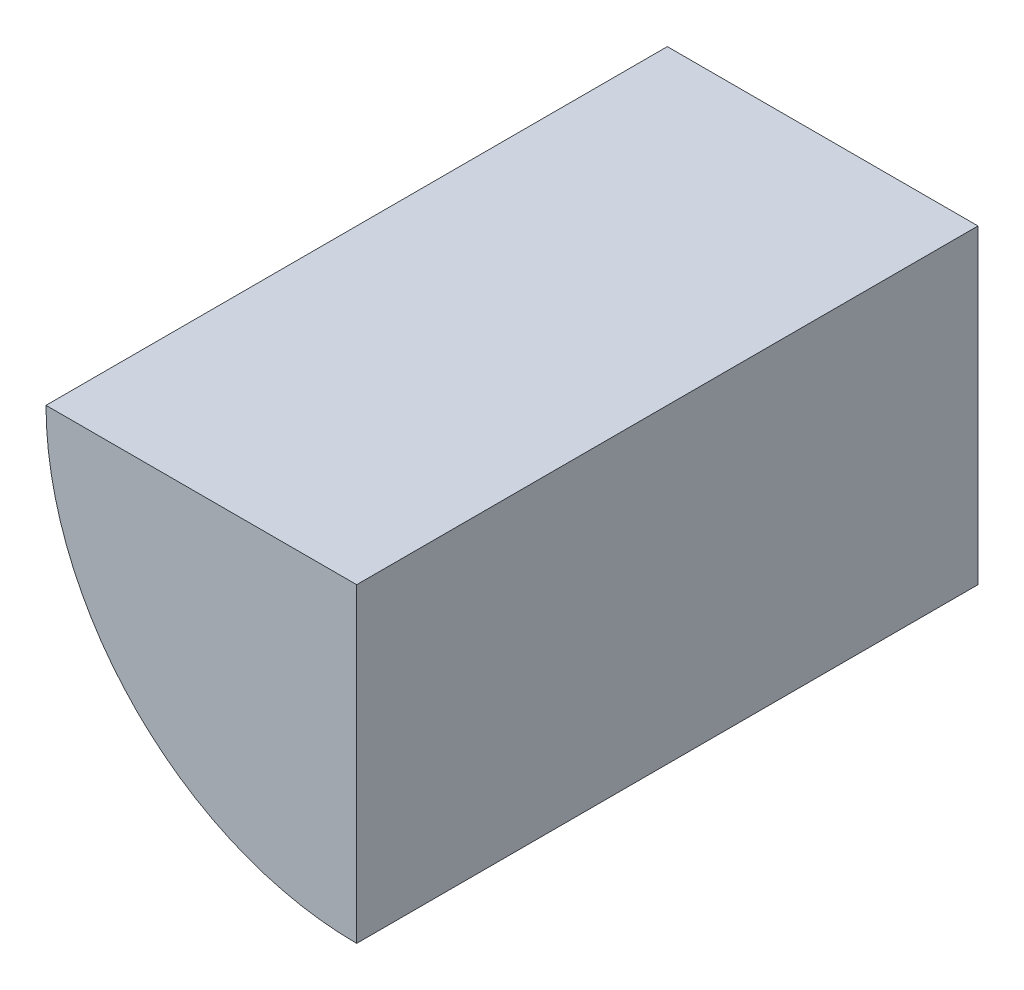
from build123d import *

# Parameters (mm, degrees)
SALIENTE_EXTRUIR1_DEPTH = 50
CROQUIS2_R              = 5
CORTAR_EXTRUIR1_DEPTH   = 10


with BuildPart() as part:
    # Croquis1 → Saliente-Extruir1 (new body)
    with BuildSketch(Plane.XY):
        with BuildLine():
            Line((0, 0), (0, -25))
            ThreePointArc((0, -25), (-17.67766953, -17.67766953), (-25, 0))
            Line((-25, 0), (0, 0))
        make_face()
    extrude(amount=SALIENTE_EXTRUIR1_DEPTH)

    # Croquis2 → Cortar-Extruir1 (cut)
    with BuildSketch(Plane(origin=(0, 0, 0), x_dir=(-1, 0, 0), z_dir=(0, 0, -1))):
        with Locations((10.56446681, -9.663348116)):
            Circle(CROQUIS2_R)
    extrude(amount=-CORTAR_EXTRUIR1_DEPTH, mode=Mode.SUBTRACT)


solid = part.part
